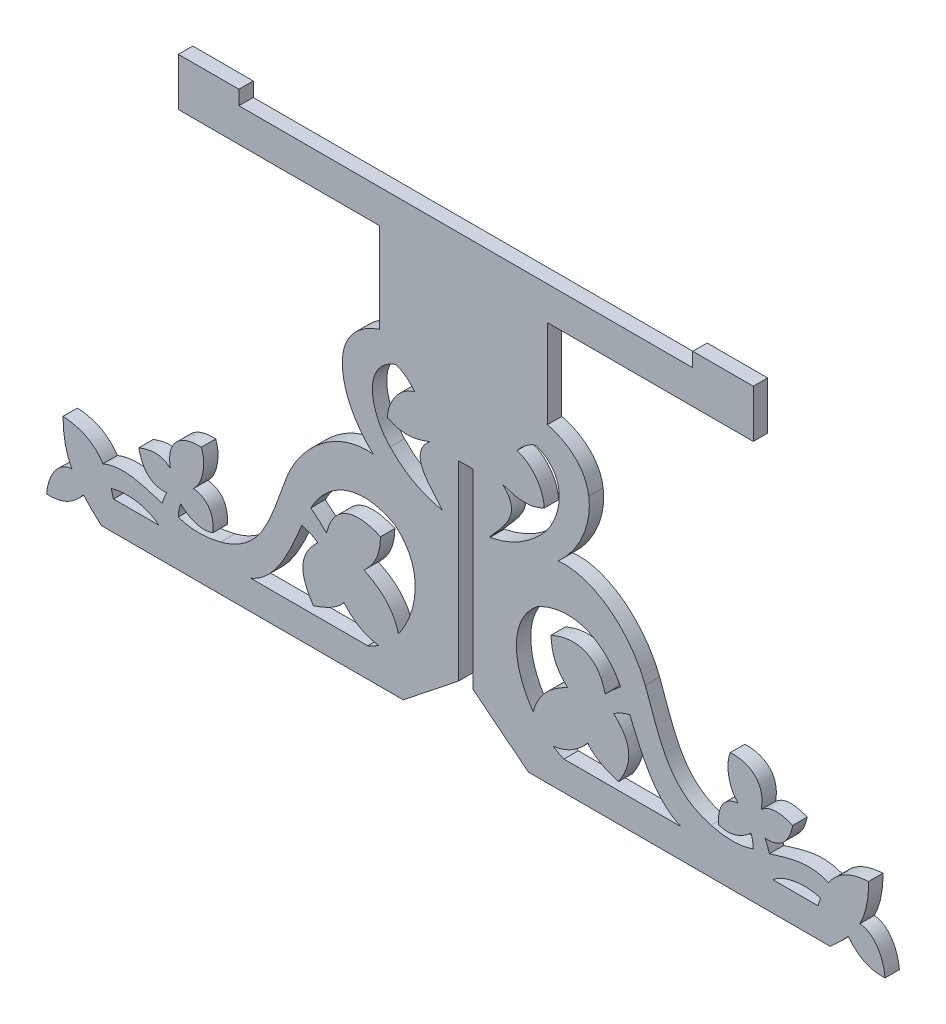
from build123d import *

# Parameters (mm, degrees)
RESSALTO_EXTRUS_O1_DEPTH = 2


with BuildPart() as part:
    # Model → Ressalto-extrusão1 (new body)
    with BuildSketch(Plane.XY):
        with BuildLine():
            Line((-12.9004, -101.3152), (-12.9004, -88.8288))
            Line((-12.9004, -88.8288), (-40.9159, -88.8288))
            add(Edge.make_bspline(
                [(-40.9159, -88.8288), (-40.9159, -86.6101), (-40.9159, -84.3915), (-40.9159, -82.1728)],
                knots=[0.372881356, 0.372881356, 0.372881356, 0.372881356, 0.389830508, 0.389830508, 0.389830508, 0.389830508], degree=3))
            Line((-40.9159, -82.1728), (-32.4949, -82.1728))
            Line((-32.4949, -82.1728), (-32.4949, -84.162))
            add(Edge.make_bspline(
                [(-32.4949, -84.162), (24.9205, -84.162), (-26.7524, -84.162), (30.663, -84.162)],
                knots=[0.423728814, 0.423728814, 0.423728814, 0.423728814, 0.440677966, 0.440677966, 0.440677966, 0.440677966], degree=3))
            Line((30.663, -84.162), (30.663, -82.1728))
            Line((30.663, -82.1728), (39.0841, -82.1728))
            add(Edge.make_bspline(
                [(39.0841, -82.1728), (39.0841, -84.3915), (39.0841, -86.6101), (39.0841, -88.8288)],
                knots=[0.474576271, 0.474576271, 0.474576271, 0.474576271, 0.491525424, 0.491525424, 0.491525424, 0.491525424], degree=3))
            Line((39.0841, -88.8288), (10.4329, -88.8288))
            Line((10.4329, -88.8288), (10.4329, -101.1372))
            add(Edge.make_bspline(
                [(10.4329, -101.1372), (13.1695, -101.8028), (15.7564, -103.704), (16.1954, -106.8656)],
                knots=[0.525423729, 0.525423729, 0.525423729, 0.525423729, 0.542372881, 0.542372881, 0.542372881, 0.542372881], degree=3))
            add(Edge.make_bspline(
                [(16.1954, -106.8656), (16.6239, -109.9517), (15.1905, -113.8641), (11.9443, -116.8092)],
                knots=[0.542372881, 0.542372881, 0.542372881, 0.542372881, 0.559322034, 0.559322034, 0.559322034, 0.559322034], degree=3))
            add(Edge.make_bspline(
                [(11.9443, -116.8092), (17.1529, -116.2553), (22.1924, -120.7679), (24.0657, -125.7413)],
                knots=[0.559322034, 0.559322034, 0.559322034, 0.559322034, 0.576271186, 0.576271186, 0.576271186, 0.576271186], degree=3))
            add(Edge.make_bspline(
                [(24.0657, -125.7413), (26.2012, -131.4111), (27.2401, -136.4249), (33.2026, -138.0166)],
                knots=[0.576271186, 0.576271186, 0.576271186, 0.576271186, 0.593220339, 0.593220339, 0.593220339, 0.593220339], degree=3))
            add(Edge.make_bspline(
                [(33.2026, -138.0166), (35.1521, -138.537), (37.264, -138.623), (39.0848, -137.933)],
                knots=[0.593220339, 0.593220339, 0.593220339, 0.593220339, 0.610169492, 0.610169492, 0.610169492, 0.610169492], degree=3))
            add(Edge.make_bspline(
                [(39.0848, -137.933), (39.1033, -137.367), (38.9379, -136.588), (38.7632, -136.1891)],
                knots=[0.610169492, 0.610169492, 0.610169492, 0.610169492, 0.627118644, 0.627118644, 0.627118644, 0.627118644], degree=3))
            add(Edge.make_bspline(
                [(38.7632, -136.1891), (37.4275, -137.4389), (35.8047, -137.9979), (34.2799, -137.4339)],
                knots=[0.627118644, 0.627118644, 0.627118644, 0.627118644, 0.644067797, 0.644067797, 0.644067797, 0.644067797], degree=3))
            add(Edge.make_bspline(
                [(34.2799, -137.4339), (34.0939, -136.0501), (34.4783, -133.7397), (37.0016, -133.46)],
                knots=[0.644067797, 0.644067797, 0.644067797, 0.644067797, 0.661016949, 0.661016949, 0.661016949, 0.661016949], degree=3))
            add(Edge.make_bspline(
                [(37.0016, -133.46), (35.8223, -132.5106), (35.1117, -129.8687), (35.8848, -127.924)],
                knots=[0.661016949, 0.661016949, 0.661016949, 0.661016949, 0.677966102, 0.677966102, 0.677966102, 0.677966102], degree=3))
            add(Edge.make_bspline(
                [(35.8848, -127.924), (38.5702, -127.7685), (40.8278, -129.2806), (40.191, -132.64)],
                knots=[0.677966102, 0.677966102, 0.677966102, 0.677966102, 0.694915254, 0.694915254, 0.694915254, 0.694915254], degree=3))
            add(Edge.make_bspline(
                [(40.191, -132.64), (41.4985, -131.5152), (42.8521, -131.6994), (44.5892, -132.3417)],
                knots=[0.694915254, 0.694915254, 0.694915254, 0.694915254, 0.711864407, 0.711864407, 0.711864407, 0.711864407], degree=3))
            add(Edge.make_bspline(
                [(44.5892, -132.3417), (44.161, -134.4229), (43.0845, -135.9966), (40.6999, -135.8202)],
                knots=[0.711864407, 0.711864407, 0.711864407, 0.711864407, 0.728813559, 0.728813559, 0.728813559, 0.728813559], degree=3))
            add(Edge.make_bspline(
                [(40.6999, -135.8202), (41.0315, -136.4715), (41.1853, -136.8554), (41.3317, -137.3933)],
                knots=[0.728813559, 0.728813559, 0.728813559, 0.728813559, 0.745762712, 0.745762712, 0.745762712, 0.745762712], degree=3))
            add(Edge.make_bspline(
                [(41.3317, -137.3933), (44.0855, -136.5639), (46.7565, -135.5938), (49.5739, -136.7659)],
                knots=[0.745762712, 0.745762712, 0.745762712, 0.745762712, 0.762711864, 0.762711864, 0.762711864, 0.762711864], degree=3))
            add(Edge.make_bspline(
                [(49.5739, -136.7659), (50.8193, -134.8971), (52.6196, -133.9899), (55.135, -133.8269)],
                knots=[0.762711864, 0.762711864, 0.762711864, 0.762711864, 0.779661017, 0.779661017, 0.779661017, 0.779661017], degree=3))
            add(Edge.make_bspline(
                [(55.135, -133.8269), (55.1431, -136.2251), (54.7052, -138.0199), (53.9183, -139.5387)],
                knots=[0.779661017, 0.779661017, 0.779661017, 0.779661017, 0.796610169, 0.796610169, 0.796610169, 0.796610169], degree=3))
            add(Edge.make_bspline(
                [(53.9183, -139.5387), (55.7595, -139.63), (57.2141, -141.7372), (57.4174, -144.3247)],
                knots=[0.796610169, 0.796610169, 0.796610169, 0.796610169, 0.813559322, 0.813559322, 0.813559322, 0.813559322], degree=3))
            add(Edge.make_bspline(
                [(57.4174, -144.3247), (55.5273, -144.3945), (53.9499, -143.8818), (52.3665, -141.949)],
                knots=[0.813559322, 0.813559322, 0.813559322, 0.813559322, 0.830508475, 0.830508475, 0.830508475, 0.830508475], degree=3))
            add(Edge.make_bspline(
                [(52.3665, -141.949), (52.3457, -141.921), (52.3243, -141.8943), (52.3032, -141.8668)],
                knots=[0.830508475, 0.830508475, 0.830508475, 0.830508475, 0.847457627, 0.847457627, 0.847457627, 0.847457627], degree=3))
            add(Edge.make_bspline(
                [(52.3032, -141.8668), (51.5802, -142.6964), (50.7392, -143.4882), (49.804, -144.3246)],
                knots=[0.847457627, 0.847457627, 0.847457627, 0.847457627, 0.86440678, 0.86440678, 0.86440678, 0.86440678], degree=3))
            Line((49.804, -144.3246), (7.7955, -144.3246))
            Line((7.7955, -144.3246), (0.0841, -138.2088))
            Line((0.0841, -138.2088), (0.0841, -111.6563))
            Line((0.0841, -111.6563), (-1.9159, -111.6563))
            Line((-1.9159, -111.6563), (-1.9159, -138.2088))
            Line((-1.9159, -138.2088), (-9.6274, -144.3246))
            Line((-9.6274, -144.3246), (-51.6359, -144.3246))
            add(Edge.make_bspline(
                [(-51.6359, -144.3246), (-52.5711, -143.4882), (-53.412, -142.6964), (-54.1351, -141.8668)],
                knots=[0, 0, 0, 0, 0.016949153, 0.016949153, 0.016949153, 0.016949153], degree=3))
            add(Edge.make_bspline(
                [(-54.1351, -141.8668), (-54.1561, -141.8943), (-54.1776, -141.921), (-54.1983, -141.949)],
                knots=[0.016949153, 0.016949153, 0.016949153, 0.016949153, 0.033898305, 0.033898305, 0.033898305, 0.033898305], degree=3))
            add(Edge.make_bspline(
                [(-54.1983, -141.949), (-55.7818, -143.8818), (-57.3592, -144.3945), (-59.2492, -144.3247)],
                knots=[0.033898305, 0.033898305, 0.033898305, 0.033898305, 0.050847458, 0.050847458, 0.050847458, 0.050847458], degree=3))
            add(Edge.make_bspline(
                [(-59.2492, -144.3247), (-59.046, -141.7372), (-57.5914, -139.63), (-55.7502, -139.5387)],
                knots=[0.050847458, 0.050847458, 0.050847458, 0.050847458, 0.06779661, 0.06779661, 0.06779661, 0.06779661], degree=3))
            add(Edge.make_bspline(
                [(-55.7502, -139.5387), (-56.537, -138.0199), (-56.9749, -136.2251), (-56.9668, -133.8269)],
                knots=[0.06779661, 0.06779661, 0.06779661, 0.06779661, 0.084745763, 0.084745763, 0.084745763, 0.084745763], degree=3))
            add(Edge.make_bspline(
                [(-56.9668, -133.8269), (-54.4514, -133.9899), (-52.6511, -134.8971), (-51.4058, -136.7659)],
                knots=[0.084745763, 0.084745763, 0.084745763, 0.084745763, 0.101694915, 0.101694915, 0.101694915, 0.101694915], degree=3))
            add(Edge.make_bspline(
                [(-51.4058, -136.7659), (-48.5883, -135.5938), (-45.9174, -136.5639), (-43.1636, -137.3933)],
                knots=[0.101694915, 0.101694915, 0.101694915, 0.101694915, 0.118644068, 0.118644068, 0.118644068, 0.118644068], degree=3))
            add(Edge.make_bspline(
                [(-43.1636, -137.3933), (-43.0172, -136.8554), (-42.8634, -136.4715), (-42.5318, -135.8202)],
                knots=[0.118644068, 0.118644068, 0.118644068, 0.118644068, 0.13559322, 0.13559322, 0.13559322, 0.13559322], degree=3))
            add(Edge.make_bspline(
                [(-42.5318, -135.8202), (-44.9164, -135.9966), (-45.9929, -134.4229), (-46.4211, -132.3417)],
                knots=[0.13559322, 0.13559322, 0.13559322, 0.13559322, 0.152542373, 0.152542373, 0.152542373, 0.152542373], degree=3))
            add(Edge.make_bspline(
                [(-46.4211, -132.3417), (-44.684, -131.6994), (-43.3303, -131.5152), (-42.0229, -132.64)],
                knots=[0.152542373, 0.152542373, 0.152542373, 0.152542373, 0.169491525, 0.169491525, 0.169491525, 0.169491525], degree=3))
            add(Edge.make_bspline(
                [(-42.0229, -132.64), (-42.6597, -129.2806), (-40.4021, -127.7685), (-37.7166, -127.924)],
                knots=[0.169491525, 0.169491525, 0.169491525, 0.169491525, 0.186440678, 0.186440678, 0.186440678, 0.186440678], degree=3))
            add(Edge.make_bspline(
                [(-37.7166, -127.924), (-36.9436, -129.8687), (-37.6542, -132.5106), (-38.8335, -133.46)],
                knots=[0.186440678, 0.186440678, 0.186440678, 0.186440678, 0.203389831, 0.203389831, 0.203389831, 0.203389831], degree=3))
            add(Edge.make_bspline(
                [(-38.8335, -133.46), (-36.3102, -133.7397), (-35.9258, -136.0501), (-36.1118, -137.4339)],
                knots=[0.203389831, 0.203389831, 0.203389831, 0.203389831, 0.220338983, 0.220338983, 0.220338983, 0.220338983], degree=3))
            add(Edge.make_bspline(
                [(-36.1118, -137.4339), (-37.6366, -137.9979), (-39.2594, -137.4389), (-40.595, -136.1891)],
                knots=[0.220338983, 0.220338983, 0.220338983, 0.220338983, 0.237288136, 0.237288136, 0.237288136, 0.237288136], degree=3))
            add(Edge.make_bspline(
                [(-40.595, -136.1891), (-40.7698, -136.588), (-40.9351, -137.367), (-40.9167, -137.933)],
                knots=[0.237288136, 0.237288136, 0.237288136, 0.237288136, 0.254237288, 0.254237288, 0.254237288, 0.254237288], degree=3))
            add(Edge.make_bspline(
                [(-40.9167, -137.933), (-39.0959, -138.623), (-36.9839, -138.537), (-35.0344, -138.0166)],
                knots=[0.254237288, 0.254237288, 0.254237288, 0.254237288, 0.271186441, 0.271186441, 0.271186441, 0.271186441], degree=3))
            add(Edge.make_bspline(
                [(-35.0344, -138.0166), (-29.072, -136.4249), (-28.0331, -131.4111), (-25.8976, -125.7413)],
                knots=[0.271186441, 0.271186441, 0.271186441, 0.271186441, 0.288135593, 0.288135593, 0.288135593, 0.288135593], degree=3))
            add(Edge.make_bspline(
                [(-25.8976, -125.7413), (-24.0243, -120.7679), (-18.9848, -116.2553), (-13.7762, -116.8092)],
                knots=[0.288135593, 0.288135593, 0.288135593, 0.288135593, 0.305084746, 0.305084746, 0.305084746, 0.305084746], degree=3))
            add(Edge.make_bspline(
                [(-13.7762, -116.8092), (-17.0224, -113.8641), (-18.4558, -109.9517), (-18.0272, -106.8656)],
                knots=[0.305084746, 0.305084746, 0.305084746, 0.305084746, 0.322033898, 0.322033898, 0.322033898, 0.322033898], degree=3))
            add(Edge.make_bspline(
                [(-18.0272, -106.8656), (-17.6224, -103.9501), (-15.3913, -102.1066), (-12.9004, -101.3152)],
                knots=[0.322033898, 0.322033898, 0.322033898, 0.322033898, 0.338983051, 0.338983051, 0.338983051, 0.338983051], degree=3))
        make_face()
        with BuildLine():
            Line((2.4156, -118.6618), (2.4156, -118.7397))
            add(Edge.make_bspline(
                [(2.4156, -118.7397), (5.2833, -118.1337), (7.4563, -116.9728), (9.6195, -114.7647)],
                knots=[0.111111111, 0.111111111, 0.111111111, 0.111111111, 0.222222222, 0.222222222, 0.222222222, 0.222222222], degree=3))
            add(Edge.make_bspline(
                [(9.6195, -114.7647), (12.433, -111.8926), (13.6158, -106.2282), (8.893, -104.4415)],
                knots=[0.222222222, 0.222222222, 0.222222222, 0.222222222, 0.333333333, 0.333333333, 0.333333333, 0.333333333], degree=3))
            Line((8.893, -104.4415), (8.8176, -104.4415))
            add(Edge.make_bspline(
                [(8.8176, -104.4415), (7.8649, -104.6299), (6.7239, -105.6959), (6.1977, -106.3783)],
                knots=[0.444444444, 0.444444444, 0.444444444, 0.444444444, 0.555555556, 0.555555556, 0.555555556, 0.555555556], degree=3))
            add(Edge.make_bspline(
                [(6.1977, -106.3783), (8.3442, -106.9971), (9.9073, -109.2117), (9.9993, -111.4006)],
                knots=[0.555555556, 0.555555556, 0.555555556, 0.555555556, 0.666666667, 0.666666667, 0.666666667, 0.666666667], degree=3))
            add(Edge.make_bspline(
                [(9.9993, -111.4006), (7.7737, -112.5166), (5.9614, -112.0782), (4.1652, -111.404)],
                knots=[0.666666667, 0.666666667, 0.666666667, 0.666666667, 0.777777778, 0.777777778, 0.777777778, 0.777777778], degree=3))
            add(Edge.make_bspline(
                [(4.1652, -111.404), (7.0946, -114.0167), (4.3185, -116.3971), (2.4156, -118.6618)],
                knots=[0.777777778, 0.777777778, 0.777777778, 0.777777778, 1, 1, 1, 1], degree=3))
        make_face(mode=Mode.SUBTRACT)
        with BuildLine():
            Line((-4.2475, -118.7397), (-4.2475, -118.6619))
            add(Edge.make_bspline(
                [(-4.2475, -118.6619), (-6.1504, -116.3972), (-8.9266, -114.0168), (-5.9971, -111.404)],
                knots=[0.111111111, 0.111111111, 0.111111111, 0.111111111, 0.222222222, 0.222222222, 0.222222222, 0.222222222], degree=3))
            add(Edge.make_bspline(
                [(-5.9971, -111.404), (-7.7933, -112.0782), (-9.6056, -112.5166), (-11.8312, -111.4006)],
                knots=[0.222222222, 0.222222222, 0.222222222, 0.222222222, 0.333333333, 0.333333333, 0.333333333, 0.333333333], degree=3))
            add(Edge.make_bspline(
                [(-11.8312, -111.4006), (-11.7392, -109.2117), (-10.1761, -106.9971), (-8.0296, -106.3783)],
                knots=[0.333333333, 0.333333333, 0.333333333, 0.333333333, 0.444444444, 0.444444444, 0.444444444, 0.444444444], degree=3))
            add(Edge.make_bspline(
                [(-8.0296, -106.3783), (-8.5558, -105.6959), (-9.6968, -104.6299), (-10.6496, -104.4415)],
                knots=[0.444444444, 0.444444444, 0.444444444, 0.444444444, 0.555555556, 0.555555556, 0.555555556, 0.555555556], degree=3))
            Line((-10.6496, -104.4415), (-10.7249, -104.4415))
            add(Edge.make_bspline(
                [(-10.7249, -104.4415), (-15.4477, -106.2282), (-14.2649, -111.8926), (-11.4513, -114.7647)],
                knots=[0.666666667, 0.666666667, 0.666666667, 0.666666667, 0.777777778, 0.777777778, 0.777777778, 0.777777778], degree=3))
            add(Edge.make_bspline(
                [(-11.4513, -114.7647), (-9.2882, -116.9728), (-7.1152, -118.1337), (-4.2475, -118.7397)],
                knots=[0.777777778, 0.777777778, 0.777777778, 0.777777778, 1, 1, 1, 1], degree=3))
        make_face(mode=Mode.SUBTRACT)
        with BuildLine():
            Line((29.0258, -140.2793), (12.7362, -140.2793))
            add(Edge.make_bspline(
                [(12.7362, -140.2793), (12.222, -140.0804), (11.7171, -139.8107), (11.2295, -139.4825)],
                knots=[0.75, 0.75, 0.75, 0.75, 1, 1, 1, 1], degree=3))
            add(Edge.make_bspline(
                [(11.2295, -139.4825), (13.0658, -139.2201), (14.6921, -138.3655), (16.0476, -136.6912)],
                knots=[0, 0, 0, 0, 0.125, 0.125, 0.125, 0.125], degree=3))
            add(Edge.make_bspline(
                [(16.0476, -136.6912), (16.831, -137.8892), (18.8371, -138.7799), (20.3087, -139.233)],
                knots=[0.125, 0.125, 0.125, 0.125, 0.25, 0.25, 0.25, 0.25], degree=3))
            add(Edge.make_bspline(
                [(20.3087, -139.233), (21.9438, -136.7395), (22.7651, -134.182), (19.6643, -131.3158)],
                knots=[0.25, 0.25, 0.25, 0.25, 0.375, 0.375, 0.375, 0.375], degree=3))
            add(Edge.make_bspline(
                [(19.6643, -131.3158), (20.3829, -130.8576), (21.1444, -130.5259), (21.9025, -130.338)],
                knots=[0.375, 0.375, 0.375, 0.375, 0.5, 0.5, 0.5, 0.5], degree=3))
            add(Edge.make_bspline(
                [(21.9025, -130.338), (23.4756, -133.9898), (25.265, -138.7339), (29.0258, -140.2793)],
                knots=[0.5, 0.5, 0.5, 0.5, 0.625, 0.625, 0.625, 0.625], degree=3))
        make_face(mode=Mode.SUBTRACT)
        with BuildLine():
            Line((48.1117, -140.2793), (41.8008, -140.2793))
            add(Edge.make_bspline(
                [(41.8008, -140.2793), (43.2247, -139.0671), (45.8993, -138.4201), (48.4363, -139.1712)],
                knots=[0.5, 0.5, 0.5, 0.5, 1, 1, 1, 1], degree=3))
            add(Edge.make_bspline(
                [(48.4363, -139.1712), (48.3192, -139.5215), (48.211, -139.8904), (48.1117, -140.2793)],
                knots=[0, 0, 0, 0, 0.25, 0.25, 0.25, 0.25], degree=3))
        make_face(mode=Mode.SUBTRACT)
        with BuildLine():
            Line((-30.8577, -140.2793), (-14.5681, -140.2793))
            add(Edge.make_bspline(
                [(-14.5681, -140.2793), (-14.0538, -140.0804), (-13.549, -139.8107), (-13.0614, -139.4825)],
                knots=[0.75, 0.75, 0.75, 0.75, 1, 1, 1, 1], degree=3))
            add(Edge.make_bspline(
                [(-13.0614, -139.4825), (-14.8977, -139.2201), (-16.524, -138.3655), (-17.8794, -136.6912)],
                knots=[0, 0, 0, 0, 0.125, 0.125, 0.125, 0.125], degree=3))
            add(Edge.make_bspline(
                [(-17.8794, -136.6912), (-18.6629, -137.8892), (-20.669, -138.7799), (-22.1406, -139.233)],
                knots=[0.125, 0.125, 0.125, 0.125, 0.25, 0.25, 0.25, 0.25], degree=3))
            add(Edge.make_bspline(
                [(-22.1406, -139.233), (-23.7757, -136.7395), (-24.5969, -134.182), (-21.4962, -131.3158)],
                knots=[0.25, 0.25, 0.25, 0.25, 0.375, 0.375, 0.375, 0.375], degree=3))
            add(Edge.make_bspline(
                [(-21.4962, -131.3158), (-22.2148, -130.8576), (-22.9763, -130.5259), (-23.7343, -130.338)],
                knots=[0.375, 0.375, 0.375, 0.375, 0.5, 0.5, 0.5, 0.5], degree=3))
            add(Edge.make_bspline(
                [(-23.7343, -130.338), (-25.3074, -133.9898), (-27.0969, -138.7339), (-30.8577, -140.2793)],
                knots=[0.5, 0.5, 0.5, 0.5, 0.625, 0.625, 0.625, 0.625], degree=3))
        make_face(mode=Mode.SUBTRACT)
        with BuildLine():
            Line((-49.9435, -140.2793), (-43.6327, -140.2793))
            add(Edge.make_bspline(
                [(-43.6327, -140.2793), (-45.0566, -139.0671), (-47.7312, -138.4201), (-50.2682, -139.1712)],
                knots=[0.5, 0.5, 0.5, 0.5, 1, 1, 1, 1], degree=3))
            add(Edge.make_bspline(
                [(-50.2682, -139.1712), (-50.1511, -139.5215), (-50.0429, -139.8904), (-49.9435, -140.2793)],
                knots=[0, 0, 0, 0, 0.25, 0.25, 0.25, 0.25], degree=3))
        make_face(mode=Mode.SUBTRACT)
        with BuildLine():
            add(Edge.make_bspline(
                [(9.0006, -123.7822), (13.5481, -121.2633), (18.23, -123.0118), (20.6479, -127.6241)],
                knots=[0, 0, 0, 0, 0.142857143, 0.142857143, 0.142857143, 0.142857143], degree=3))
            add(Edge.make_bspline(
                [(20.6479, -127.6241), (19.8398, -128.2651), (19.0687, -128.9399), (18.4723, -129.5719)],
                knots=[0.142857143, 0.142857143, 0.142857143, 0.142857143, 0.285714286, 0.285714286, 0.285714286, 0.285714286], degree=3))
            add(Edge.make_bspline(
                [(18.4723, -129.5719), (17.42, -125.3139), (14.2775, -124.802), (10.9484, -126.2406)],
                knots=[0.285714286, 0.285714286, 0.285714286, 0.285714286, 0.428571429, 0.428571429, 0.428571429, 0.428571429], degree=3))
            add(Edge.make_bspline(
                [(10.9484, -126.2406), (11.0149, -128.1564), (11.4719, -129.8168), (13.2598, -131.4102)],
                knots=[0.428571429, 0.428571429, 0.428571429, 0.428571429, 0.571428571, 0.571428571, 0.571428571, 0.571428571], degree=3))
            add(Edge.make_bspline(
                [(13.2598, -131.4102), (10.8368, -132.5486), (9.0988, -134.2085), (8.4585, -136.7273)],
                knots=[0.571428571, 0.571428571, 0.571428571, 0.571428571, 0.714285714, 0.714285714, 0.714285714, 0.714285714], degree=3))
            add(Edge.make_bspline(
                [(8.4585, -136.7273), (5.7054, -132.8767), (4.8112, -127.1256), (9.0006, -123.7822)],
                knots=[0.714285714, 0.714285714, 0.714285714, 0.714285714, 1, 1, 1, 1], degree=3))
        make_face(mode=Mode.SUBTRACT)
        with BuildLine():
            add(Edge.make_bspline(
                [(-10.8324, -123.7822), (-15.38, -121.2633), (-20.0618, -123.0118), (-22.4797, -127.6241)],
                knots=[0, 0, 0, 0, 0.142857143, 0.142857143, 0.142857143, 0.142857143], degree=3))
            add(Edge.make_bspline(
                [(-22.4797, -127.6241), (-21.6717, -128.2651), (-20.9005, -128.9399), (-20.3041, -129.5719)],
                knots=[0.142857143, 0.142857143, 0.142857143, 0.142857143, 0.285714286, 0.285714286, 0.285714286, 0.285714286], degree=3))
            add(Edge.make_bspline(
                [(-20.3041, -129.5719), (-19.2519, -125.3139), (-16.1094, -124.802), (-12.7803, -126.2406)],
                knots=[0.285714286, 0.285714286, 0.285714286, 0.285714286, 0.428571429, 0.428571429, 0.428571429, 0.428571429], degree=3))
            add(Edge.make_bspline(
                [(-12.7803, -126.2406), (-12.8468, -128.1564), (-13.3038, -129.8168), (-15.0917, -131.4102)],
                knots=[0.428571429, 0.428571429, 0.428571429, 0.428571429, 0.571428571, 0.571428571, 0.571428571, 0.571428571], degree=3))
            add(Edge.make_bspline(
                [(-15.0917, -131.4102), (-12.6687, -132.5486), (-10.9307, -134.2085), (-10.2904, -136.7273)],
                knots=[0.571428571, 0.571428571, 0.571428571, 0.571428571, 0.714285714, 0.714285714, 0.714285714, 0.714285714], degree=3))
            add(Edge.make_bspline(
                [(-10.2904, -136.7273), (-7.5373, -132.8767), (-6.643, -127.1256), (-10.8324, -123.7822)],
                knots=[0.714285714, 0.714285714, 0.714285714, 0.714285714, 1, 1, 1, 1], degree=3))
        make_face(mode=Mode.SUBTRACT)
    extrude(amount=RESSALTO_EXTRUS_O1_DEPTH)


solid = part.part
